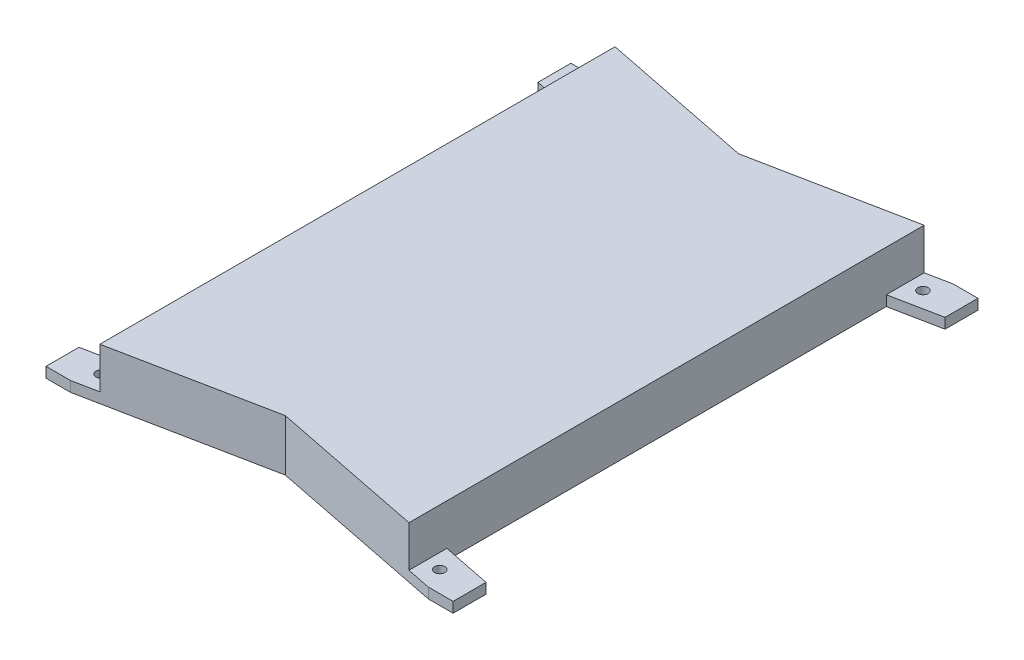
from build123d import *

# Parameters (mm, degrees)
BOSS_EXTRUDE1_DEPTH = 5
SKETCH3_R           = 2.5
CUT_EXTRUDE1_DEPTH  = 162.241436536
BOSS_EXTRUDE2_DEPTH = 20
BOSS_EXTRUDE3_DEPTH = 5


with BuildPart() as part:
    # Sketch1 → Boss-Extrude1 (new body)
    with BuildSketch(Plane(origin=(0, 0, 0), x_dir=(1, 0, 0), z_dir=(0, 1, 0))):
        Polygon((-75, 106.6), (-75, -106.6), (-98.766968108, -111.353393622), (-98.766968108, -127.353393622), (-86.766968108, -127.353393622), (-75, -125), (0, -110), (75, -125), (86.766968108, -127.353393622), (98.766968108, -127.353393622), (98.766968108, -111.353393622), (75, -106.6), (75, 106.6), (98.766968108, 111.353393622), (98.766968108, 127.353393622), (86.766968108, 127.353393622), (75, 125), (0, 110), (-75, 125), (-86.766968108, 127.353393622), (-98.766968108, 127.353393622), (-98.766968108, 111.353393622), align=None)
    extrude(amount=BOSS_EXTRUDE1_DEPTH)

    # Sketch3 → Cut-Extrude1 (cut, through all)
    with BuildSketch(Plane(origin=(0, 5, 0), x_dir=(1, 0, 0), z_dir=(0, 1, 0))):
        Polygon((-73, 122.560392195), (-73, -122.560392195), (0, -107.960392195), (73, -122.560392195), (73, 122.560392195), (0, 107.960392195), align=None)
        with Locations((82.176846176, -117.235369235)):
            Circle(SKETCH3_R)
        with Locations((-82.176846176, -117.235369235)):
            Circle(SKETCH3_R)
        with Locations((-82.176846176, 117.235369235)):
            Circle(SKETCH3_R)
        with Locations((82.176846176, 117.235369235)):
            Circle(SKETCH3_R)
    extrude(amount=-CUT_EXTRUDE1_DEPTH, mode=Mode.SUBTRACT)

    # Sketch4 → Boss-Extrude2 (add)
    with BuildSketch(Plane(origin=(0, 5, 0), x_dir=(1, 0, 0), z_dir=(0, 1, 0))):
        Polygon((-75, 125), (-75, -125), (0, -110), (75, -125), (75, 125), (0, 110), align=None)
        Polygon((0, -107.960392195), (73, -122.560392195), (73, 122.560392195), (0, 107.960392195), (-73, 122.560392195), (-73, -122.560392195), align=None, mode=Mode.SUBTRACT)
    extrude(amount=BOSS_EXTRUDE2_DEPTH)

    # Sketch5 → Boss-Extrude3 (add)
    with BuildSketch(Plane(origin=(0, 25, 0), x_dir=(1, 0, 0), z_dir=(0, 1, 0))):
        Polygon((75, 125), (0, 110), (-75, 125), (-75, -125), (0, -110), (75, -125), align=None)
    extrude(amount=-BOSS_EXTRUDE3_DEPTH)


solid = part.part
